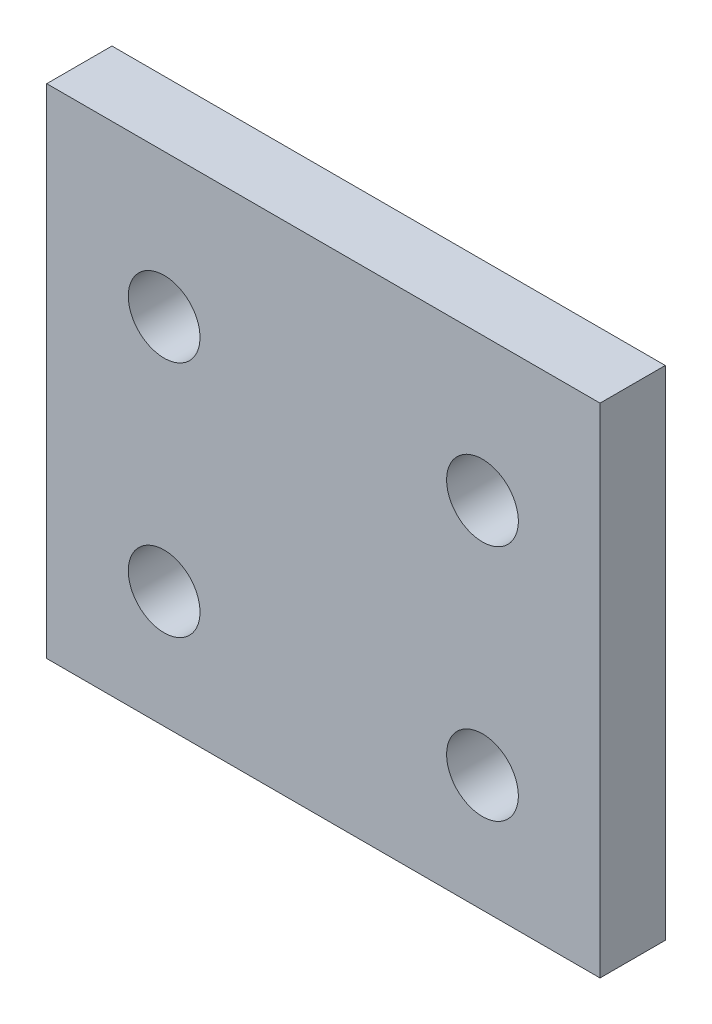
from build123d import *

# Parameters (mm, degrees)
SKETCH1_W           = 21.21128765
SKETCH1_H           = 19.08604853
BOSS_EXTRUDE1_DEPTH = 2.5
SKETCH2_R           = 1.375
CUT_EXTRUDE1_DEPTH  = 29.643428082


with BuildPart() as part:
    # Sketch1 → Boss-Extrude1 (new body)
    with BuildSketch(Plane.XY):
        with Locations((10.605643825, 9.543024265)):
            Rectangle(SKETCH1_W, SKETCH1_H)
    extrude(amount=BOSS_EXTRUDE1_DEPTH)

    # Sketch2 → Cut-Extrude1 (cut, through all)
    with BuildSketch(Plane(origin=(0, 0, 0), x_dir=(-1, 0, 0), z_dir=(0, 0, -1))):
        with Locations((-16.70317329, 13.5977062)):
            Circle(SKETCH2_R)
        with Locations((-4.50061561, 13.5977062)):
            Circle(SKETCH2_R)
        with Locations((-16.70317329, 4.48009656)):
            Circle(SKETCH2_R)
        with Locations((-4.50061561, 4.48009656)):
            Circle(SKETCH2_R)
    extrude(amount=-CUT_EXTRUDE1_DEPTH, mode=Mode.SUBTRACT)


solid = part.part
